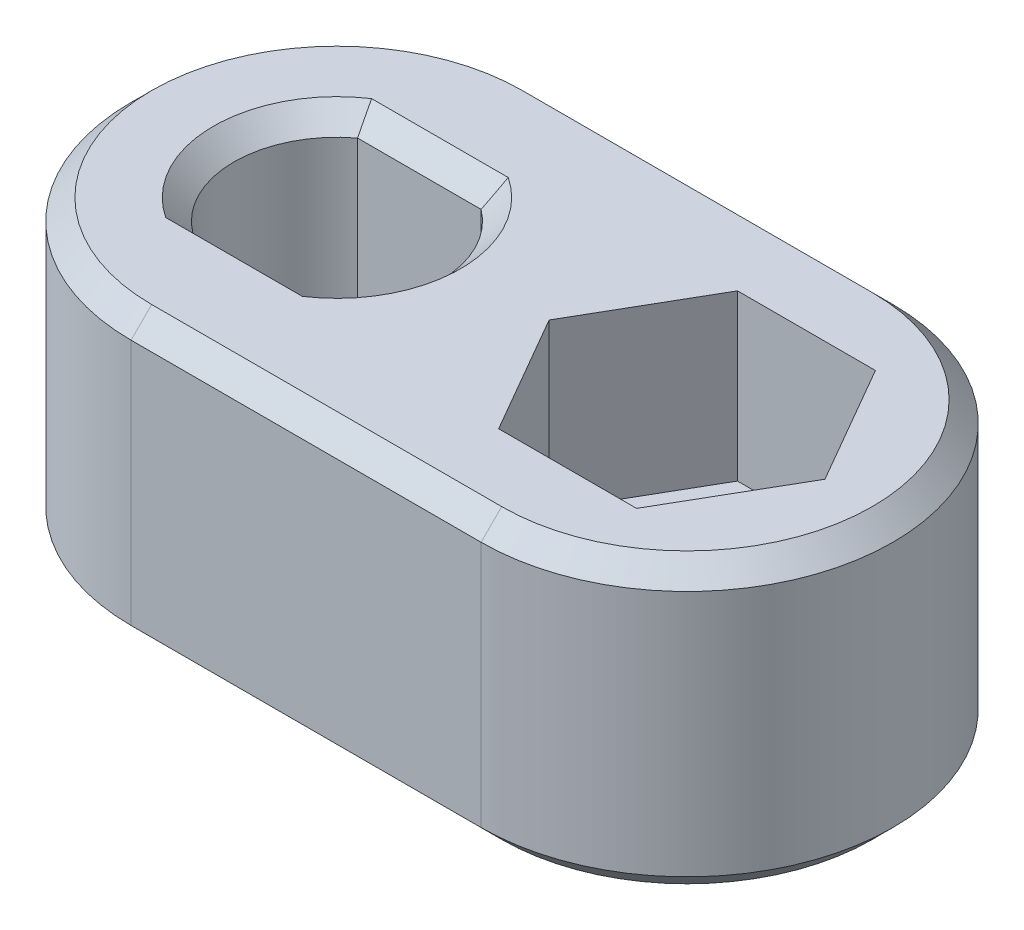
from build123d import *

# Parameters (mm, degrees)
EXTRUDE_1_DEPTH              = 7
CUT_EXTRUDE_1_DEPTH          = 4
HOLE_WIZARD_M3_1_D           = 3.4
HOLE_WIZARD_M3_1_DEPTH       = 7.5
HOLE_WIZARD_M3_1_CSINK_D     = 6.72
HOLE_WIZARD_M3_1_CSINK_ANGLE = 90
HOLE_WIZARD_M3_1_TIP         = 1.021463052
HOLE_WIZARD_1_D              = 4.15
CUT_EXTRUDE_2_DEPTH          = 4
CHAMFER_1_SIZE               = 0.5


with BuildPart() as part:
    # 草图1 → 凸台-拉伸1 (new body)
    with BuildSketch(Plane(origin=(0, 0, 0), x_dir=(1, 0, 0), z_dir=(0, 1, 0))):
        with BuildLine():
            Line((0, 5), (8.5, 5))
            ThreePointArc((8.5, 5), (13.5, 0), (8.5, -5))
            Line((8.5, -5), (0, -5))
            ThreePointArc((0, -5), (-5, 0), (0, 5))
        make_face()
    extrude(amount=EXTRUDE_1_DEPTH)

    # 草图2 → 切除-拉伸1 (cut)
    with BuildSketch(Plane(origin=(0, 7, 0), x_dir=(1, 0, 0), z_dir=(0, 1, 0))):
        with BuildLine():
            ThreePointArc((2.5, 0), (2.236067977, 1.118033989), (1.5, 2))
            Line((1.5, 2), (-1.5, 2))
            ThreePointArc((-1.5, 2), (-2.236067977, 1.118033989), (-2.5, 0))
            Line((-2.5, 0), (2.5, 0))
        make_face()
        with BuildLine():
            ThreePointArc((1.5, -2), (2.236067977, -1.118033989), (2.5, 0))
            Line((2.5, 0), (-2.5, 0))
            ThreePointArc((-2.5, 0), (-2.236067977, -1.118033989), (-1.5, -2))
            Line((-1.5, -2), (1.5, -2))
        make_face()
    extrude(amount=-CUT_EXTRUDE_1_DEPTH, mode=Mode.SUBTRACT)

    # M3 六角凹锥坑螺钉的锥形沉头孔1
    with Locations(Plane(origin=(0, 0, 0), x_dir=(-1, 0, 0), z_dir=(0, -1, 0))):
        with Locations((0, 0)):
            CounterSinkHole(HOLE_WIZARD_M3_1_D / 2, HOLE_WIZARD_M3_1_CSINK_D / 2, depth=HOLE_WIZARD_M3_1_DEPTH, counter_sink_angle=HOLE_WIZARD_M3_1_CSINK_ANGLE)
            with Locations((0, 0, -(HOLE_WIZARD_M3_1_DEPTH + HOLE_WIZARD_M3_1_TIP / 2))):  # 118° drill point
                Cone(0, HOLE_WIZARD_M3_1_D / 2, HOLE_WIZARD_M3_1_TIP, mode=Mode.SUBTRACT)

    # 孔1 (through all)
    with Locations(Plane(origin=(0, 0, 0), x_dir=(-1, 0, 0), z_dir=(0, -1, 0))):
        with Locations((-8.5, 0)):
            Hole(HOLE_WIZARD_1_D / 2)

    # 草图9 → 切除-拉伸2 (cut)
    with BuildSketch(Plane(origin=(0, 7, 0), x_dir=(1, 0, 0), z_dir=(0, 1, 0))):
        Polygon((10.174315781, 2.9), (6.825684219, 2.9), (5.151368439, 0), (6.825684219, -2.9), (10.174315781, -2.9), (11.848631561, 0), align=None)
    extrude(amount=-CUT_EXTRUDE_2_DEPTH, mode=Mode.SUBTRACT)

    # 倒角1
    chamfer_1_edges = [part.edges().sort_by_distance(p)[0] for p in [
        (13.5, 7, 0),
        (4.25, 7, -5),
        (-2.5, 7, 0),
        (0, 7, 2),
        (2.5, 7, 0),
        (0, 7, -2),
        (-5, 7, 0),
        (4.25, 0, -5),
        (13.5, 0, 0),
        (4.25, 0, 5),
        (-5, 0, 0),
        (4.25, 7, 5),
    ]]
    chamfer(chamfer_1_edges, length=CHAMFER_1_SIZE)


solid = part.part
